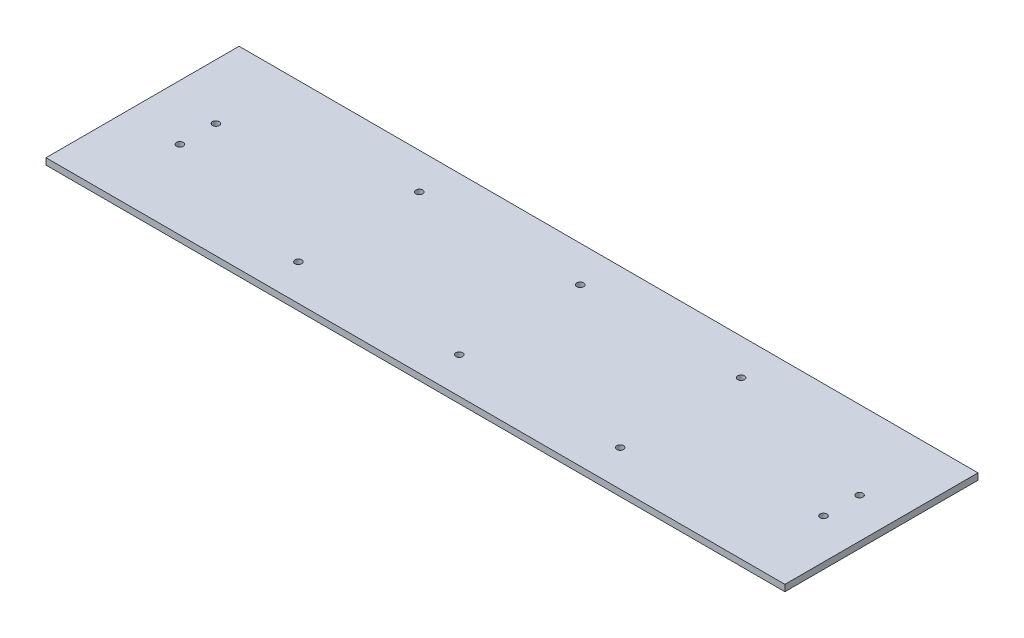
from build123d import *

# Parameters (mm, degrees)
SKETCH1_W           = 574
SKETCH1_H           = 150
SKETCH1_R           = 2.65
BOSS_EXTRUDE1_DEPTH = 5


with BuildPart() as part:
    # Sketch1 → Boss-Extrude1 (new body)
    with BuildSketch(Plane(origin=(0, 0, 0), x_dir=(1, 0, 0), z_dir=(0, 1, 0))):
        with Locations((287, 75)):
            Rectangle(SKETCH1_W, SKETCH1_H)
        with Locations(Location((43, 61, 0), (0, 0, 270))):
            Circle(SKETCH1_R, mode=Mode.SUBTRACT)
        with Locations(Location((168, 28, 0), (0, 0, 270))):
            Circle(SKETCH1_R, mode=Mode.SUBTRACT)
        with Locations(Location((293, 28, 0), (0, 0, 270))):
            Circle(SKETCH1_R, mode=Mode.SUBTRACT)
        with Locations(Location((418, 28, 0), (0, 0, 270))):
            Circle(SKETCH1_R, mode=Mode.SUBTRACT)
        with Locations(Location((543, 61, 0), (0, 0, 270))):
            Circle(SKETCH1_R, mode=Mode.SUBTRACT)
        with Locations(Location((543, 89, 0), (0, 0, 90))):
            Circle(SKETCH1_R, mode=Mode.SUBTRACT)
        with Locations(Location((418, 122, 0), (0, 0, 90))):
            Circle(SKETCH1_R, mode=Mode.SUBTRACT)
        with Locations(Location((293, 122, 0), (0, 0, 90))):
            Circle(SKETCH1_R, mode=Mode.SUBTRACT)
        with Locations(Location((168, 122, 0), (0, 0, 90))):
            Circle(SKETCH1_R, mode=Mode.SUBTRACT)
        with Locations(Location((43, 89, 0), (0, 0, 90))):
            Circle(SKETCH1_R, mode=Mode.SUBTRACT)
    extrude(amount=BOSS_EXTRUDE1_DEPTH)


solid = part.part
